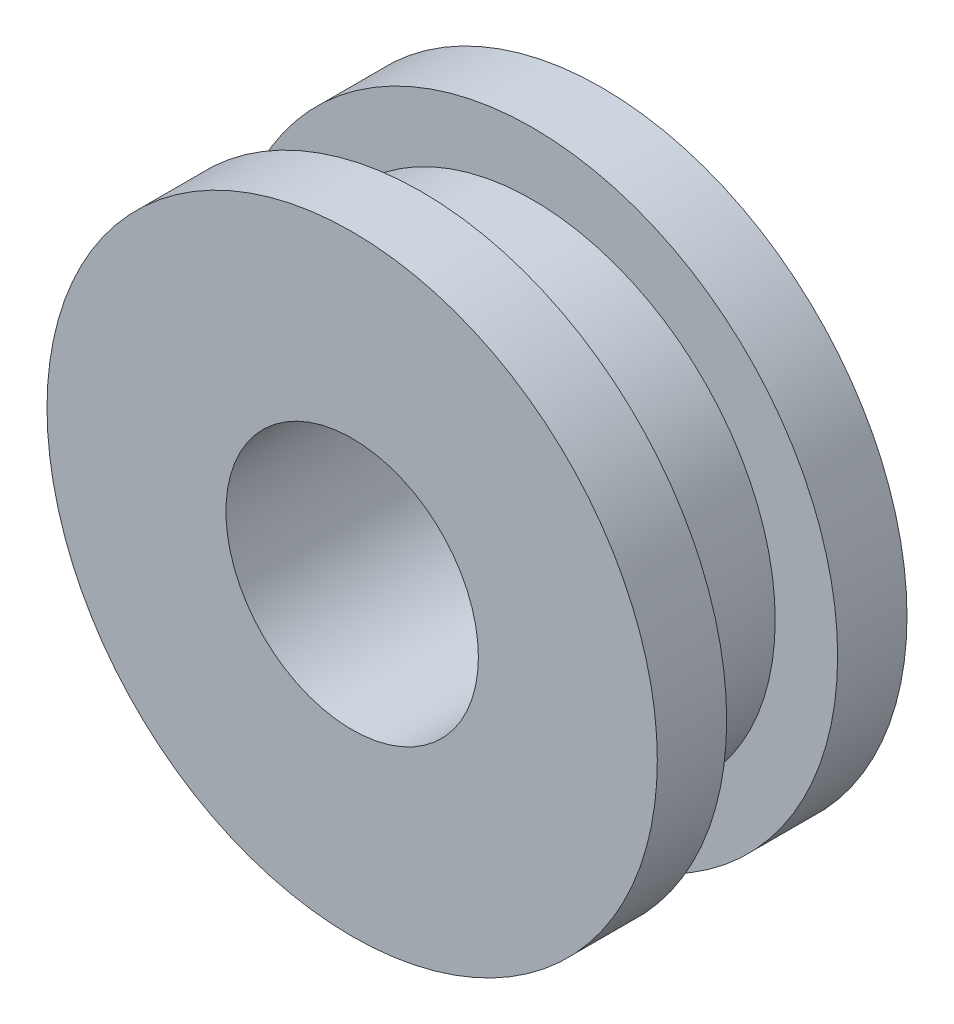
from build123d import *


with BuildPart() as part:
    # Sketch1 → Revolve1 (revolve)
    with BuildSketch(Plane(origin=(0, 0, 0), x_dir=(0, 0, -1), z_dir=(1, 0, 0)), mode=Mode.PRIVATE) as revolve1_sk:
        Polygon((-4.5, 11), (-2, 11), (-2, 8.75), (2, 8.75), (2, 11), (4.5, 11), (4.5, 4.55), (-4.5, 4.55), align=None)
    revolve(revolve1_sk.sketch.rotate(Axis((0, 0, 12.329452155), (0, 0, -1)), 90), axis=Axis((0, 0, 12.329452155), (0, 0, -1)))


solid = part.part
